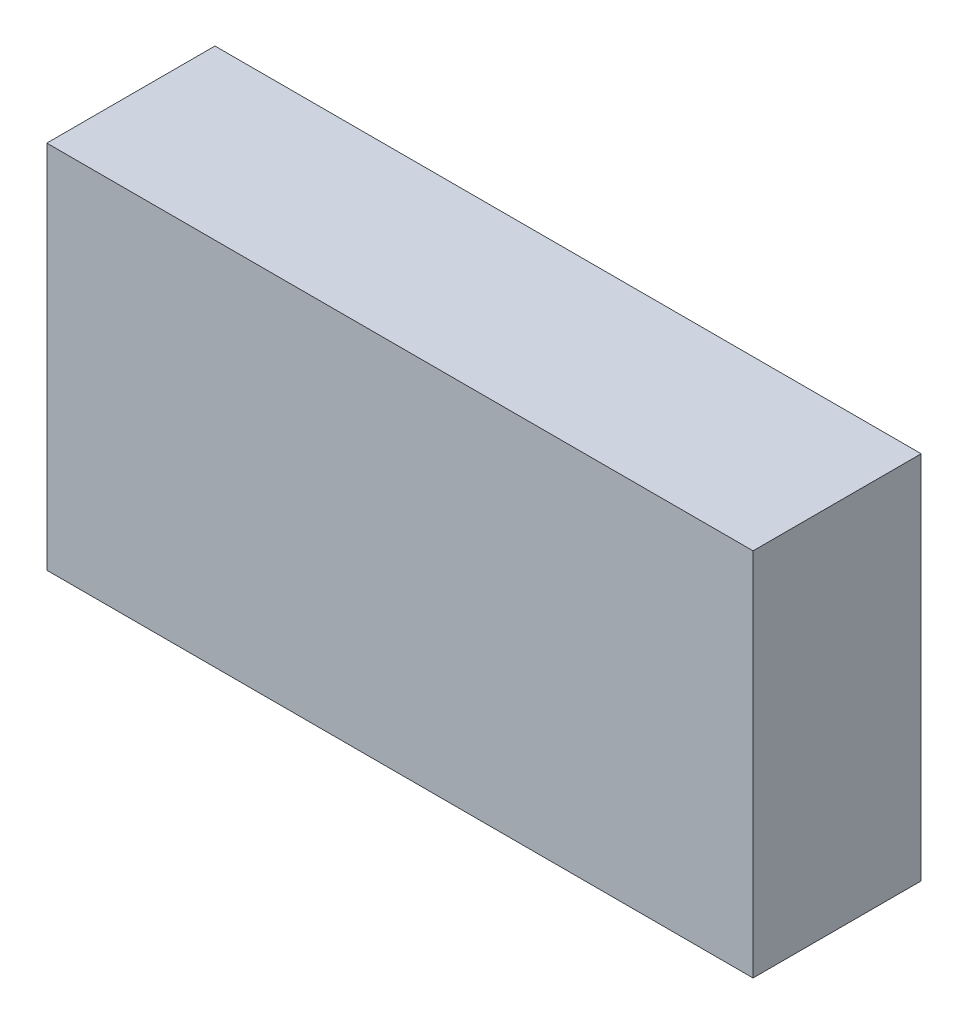
from build123d import *

# Parameters (mm, degrees)
SKETCH2_W           = 10
SKETCH2_H           = 22
BOSS_EXTRUDE1_DEPTH = 21
SKETCH3_R           = 2
CUT_EXTRUDE1_DEPTH  = 5


with BuildPart() as part:
    # Sketch2 → Boss-Extrude1 (new, symmetric)
    with BuildSketch(Plane(origin=(0, 0, 0), x_dir=(0, 0, -1), z_dir=(1, 0, 0))):
        Rectangle(SKETCH2_W, SKETCH2_H)
    extrude(amount=BOSS_EXTRUDE1_DEPTH, both=True)

    # Sketch3 → Cut-Extrude1 (cut)
    with BuildSketch(Plane.XZ.offset(11)):
        with Locations(Location((-16, 0, 0), (0, 0, 270))):
            Circle(SKETCH3_R)
        with Locations(Location((-5, 0, 0), (0, 0, 270))):
            Circle(SKETCH3_R)
    extrude(amount=-CUT_EXTRUDE1_DEPTH, mode=Mode.SUBTRACT)


solid = part.part
